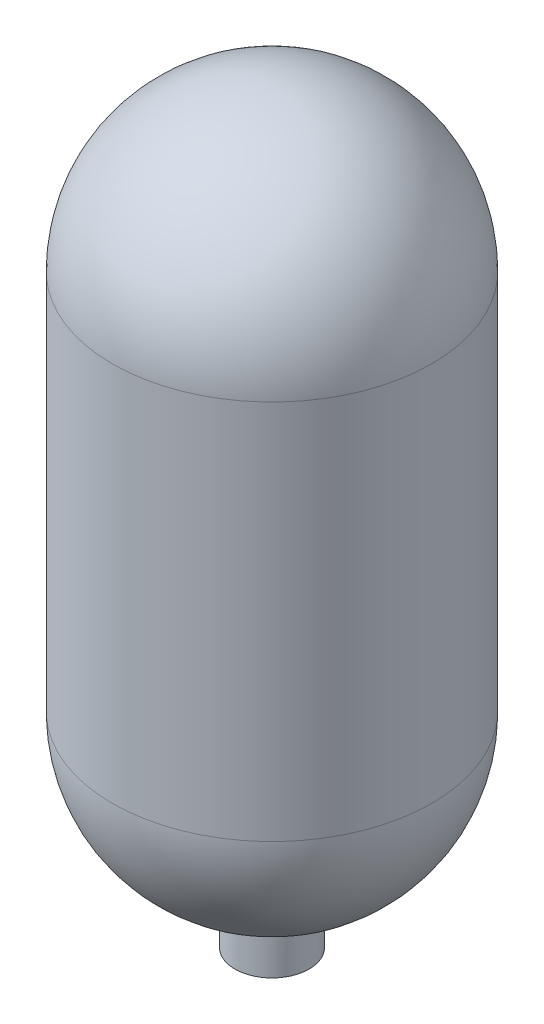
from build123d import *

# Parameters (mm, degrees)
M18X1_5_TAPPED_HOLE1_D     = 16.5
M18X1_5_TAPPED_HOLE1_DEPTH = 15.042899893
M18X1_5_TAPPED_HOLE1_TIP   = 4.957100107
FILLET1_R                  = 5


with BuildPart() as part:
    # Sketch1 → Revolve1 (revolve)
    with BuildSketch(Plane.XY, mode=Mode.PRIVATE) as revolve1_sk:
        with BuildLine():
            Line((0, 0), (15, 0))
            Line((15, 0), (15, 20))
            ThreePointArc((15, 20), (50.634721289, 42.776909193), (64.5, 82.731570999))
            Line((64.5, 82.731570999), (64.5, 236.5))
            ThreePointArc((64.5, 236.5), (45.608387387, 282.108387387), (0, 301))
            Line((0, 301), (0, 0))
        make_face()
    revolve(revolve1_sk.sketch.rotate(Axis((0, 0, 0), (0, 1, 0)), 90), axis=Axis((0, 0, 0), (0, 1, 0)))

    # M18x1.5 Tapped Hole1
    with Locations(Plane(origin=(0, 0, 0), x_dir=(-1, 0, 0), z_dir=(0, -1, 0))):
        with Locations((0, 0)):
            Hole(M18X1_5_TAPPED_HOLE1_D / 2, depth=M18X1_5_TAPPED_HOLE1_DEPTH)
            with Locations((0, 0, -(M18X1_5_TAPPED_HOLE1_DEPTH + M18X1_5_TAPPED_HOLE1_TIP / 2))):  # 118° drill point
                Cone(0, M18X1_5_TAPPED_HOLE1_D / 2, M18X1_5_TAPPED_HOLE1_TIP, mode=Mode.SUBTRACT)

    # Fillet1
    fillet1_edges = [part.edges().sort_by_distance(p)[0] for p in [
        (0, 20, 15),
    ]]
    fillet(fillet1_edges, radius=FILLET1_R)

    # Sketch4 → Cut-Revolve1 (revolve, cut)
    with BuildSketch(Plane.XY):
        with BuildLine():
            Line((8.25, 15.042899893), (8.25, 25.748443945))
            Line((8.25, 25.748443945), (17.122302158, 25.748443945))
            ThreePointArc((17.122302158, 25.748443945), (47.74425085, 47.224719396), (59.5, 82.731570999))
            Line((59.5, 82.731570999), (59.5, 236.5))
            ThreePointArc((59.5, 236.5), (42.072853481, 278.572853481), (0, 296))
            Line((0, 296), (0, 15.042899893))
            Line((0, 15.042899893), (8.25, 15.042899893))
        make_face()
    revolve(axis=Axis((0, 0, 0), (0, 1, 0)), mode=Mode.SUBTRACT)


solid = part.part
